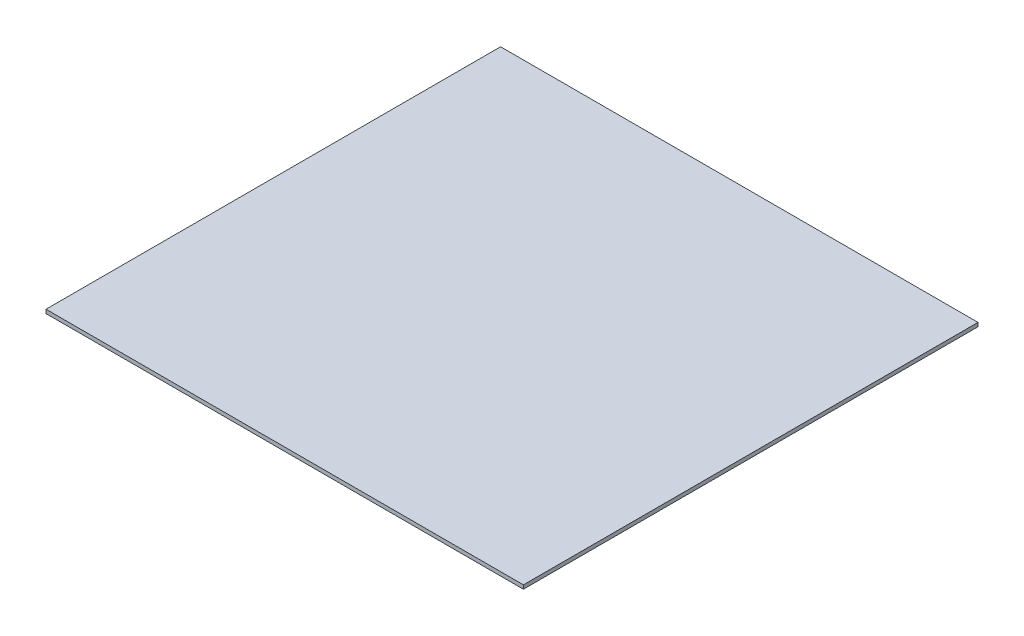
from build123d import *

# Parameters (mm, degrees)
SKETCH1_W           = 251
SKETCH1_H           = 239
BOSS_EXTRUDE1_DEPTH = 2


with BuildPart() as part:
    # Sketch1 → Boss-Extrude1 (new body)
    with BuildSketch(Plane(origin=(0, 0, 0), x_dir=(1, 0, 0), z_dir=(0, 1, 0))):
        with Locations((32.40821256, 60.18236715)):
            Rectangle(SKETCH1_W, SKETCH1_H)
    extrude(amount=BOSS_EXTRUDE1_DEPTH)


solid = part.part
